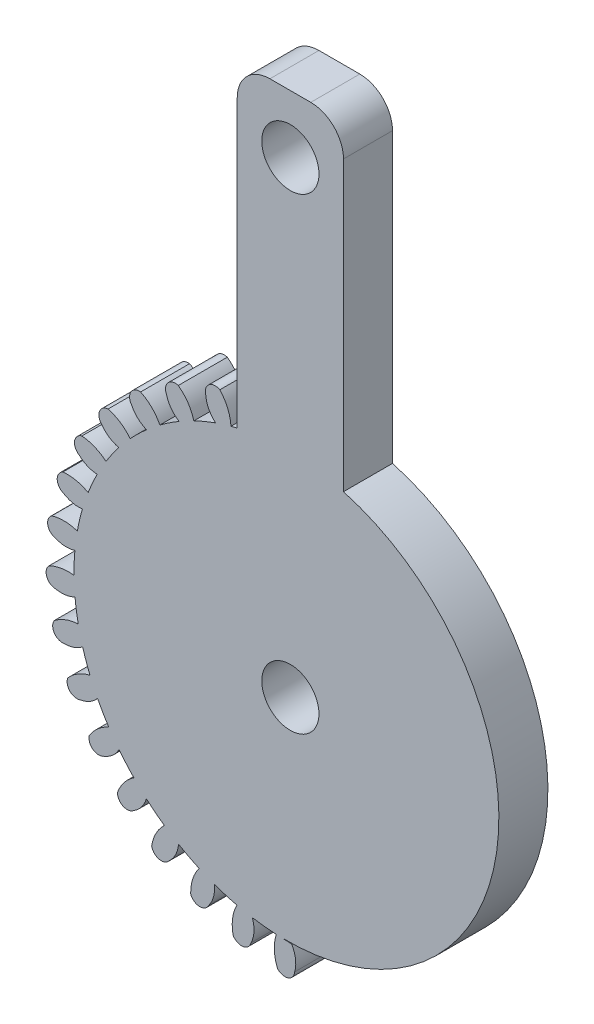
from build123d import *

# Parameters (mm, degrees)
SKETCH5_R           = 13
BOSS_EXTRUDE3_DEPTH = 3
SKETCH6_W           = 6.5
SKETCH6_H           = 20
BOSS_EXTRUDE4_DEPTH = 3
BOSS_EXTRUDE5_DEPTH = 3
SKETCH9_R           = 1.75
CUT_EXTRUDE1_DEPTH  = 3
FILLET1_R           = 2


with BuildPart() as part:
    # Sketch5 → Boss-Extrude3 (new body)
    with BuildSketch(Plane.XY.offset(3)):
        with Locations((0, 20.92523633)):
            Circle(SKETCH5_R)
    extrude(amount=BOSS_EXTRUDE3_DEPTH)

    # Sketch6 → Boss-Extrude4 (add)
    with BuildSketch(Plane.XY.offset(3)):
        with Locations((0.239986303, 43.081718219)):
            Rectangle(SKETCH6_W, SKETCH6_H)
    extrude(amount=BOSS_EXTRUDE4_DEPTH)

    # Sketch8 → Boss-Extrude5 (add)
    with BuildSketch(Plane.XY.offset(3)):
        with BuildLine():
            Line((-4.295994306, 33.146239501), (-3.38996239, 33.41049881))
            ThreePointArc((-3.38996239, 33.41049881), (-3.583611793, 34.300219718), (-4.075784869, 35.066293507))
            ThreePointArc((-4.075784869, 35.066293507), (-4.733344139, 35.009325085), (-4.939904397, 34.382457909))
            ThreePointArc((-4.939904397, 34.382457909), (-4.746199027, 33.697547192), (-4.295994306, 33.146239501))
        make_face()
        with BuildLine():
            Line((-6.479661136, 32.095481488), (-5.638197922, 32.522876474))
            ThreePointArc((-5.638197922, 32.522876474), (-5.993184011, 33.36138006), (-6.618649024, 34.023117852))
            ThreePointArc((-6.618649024, 34.023117852), (-7.254301529, 33.845422924), (-7.341262628, 33.191154353))
            ThreePointArc((-7.341262628, 33.191154353), (-7.024130865, 32.55393233), (-6.479661136, 32.095481488))
        make_face()
        with BuildLine():
            Line((-8.431105641, 30.65869425), (-7.68329101, 31.234454696))
            ThreePointArc((-7.68329101, 31.234454696), (-8.187345926, 31.992763359), (-8.924487613, 32.527296351))
            ThreePointArc((-8.924487613, 32.527296351), (-9.516266026, 32.235015826), (-9.480622702, 31.575956535))
            ThreePointArc((-9.480622702, 31.575956535), (-9.05102421, 31.008444775), (-8.431105641, 30.65869425))
        make_face()
        with BuildLine():
            Line((-10.082888425, 28.885531296), (-9.454565882, 29.589759666))
            ThreePointArc((-9.454565882, 29.589759666), (-10.090270139, 30.241667239), (-10.913613837, 30.630522663))
            ThreePointArc((-10.913613837, 30.630522663), (-11.44106706, 30.233757376), (-11.284051101, 29.592683602))
            ThreePointArc((-11.284051101, 29.592683602), (-10.756832248, 29.114494578), (-10.082888425, 28.885531296))
        make_face()
        with BuildLine():
            Line((-11.377926009, 26.837270843), (-10.89080957, 27.645629915))
            ThreePointArc((-10.89080957, 27.645629915), (-11.63619405, 28.168607317), (-12.517286067, 28.398346832))
            ThreePointArc((-12.517286067, 28.398346832), (-12.962185999, 27.910808479), (-12.689223673, 27.309874902))
            ThreePointArc((-12.689223673, 27.309874902), (-12.08260446, 26.937534209), (-11.377926009, 26.837270843))
        make_face()
        with BuildLine():
            Line((-12.271463571, 24.584698125), (-11.942387349, 25.469252055))
            ThreePointArc((-11.942387349, 25.469252055), (-12.77169253, 25.845225862), (-13.680083464, 25.907909968))
            ThreePointArc((-13.680083464, 25.907909968), (-14.027054939, 25.346447244), (-13.647579472, 24.806421351))
            ThreePointArc((-13.647579472, 24.806421351), (-12.982523874, 24.5527966), (-12.271463571, 24.584698125))
        make_face()
        with BuildLine():
            Line((-12.732621608, 22.20565914), (-12.572958051, 23.135838888))
            ThreePointArc((-12.572958051, 23.135838888), (-13.457524218, 23.351815933), (-14.361821254, 23.245278348))
            ThreePointArc((-14.361821254, 23.245278348), (-14.598873387, 22.629294678), (-14.125998959, 22.168839065))
            ThreePointArc((-14.125998959, 22.168839065), (-13.425490439, 22.042695201), (-12.732621608, 22.20565914))
        make_face()
        with BuildLine():
            Line((-12.745463094, 19.782370399), (-12.76072997, 20.726030156))
            ThreePointArc((-12.76072997, 20.726030156), (-13.669987659, 20.774546551), (-14.538939462, 20.502469076))
            ThreePointArc((-14.538939462, 20.502469076), (-14.657880036, 19.853252059), (-14.107948577, 19.488279478))
            ThreePointArc((-14.107948577, 19.488279478), (-13.396195802, 19.493975869), (-12.745463094, 19.782370399))
        make_face()
        with BuildLine():
            Line((-12.309544245, 17.398577627), (-12.499213949, 18.323105732))
            ThreePointArc((-12.499213949, 18.323105732), (-13.401740392, 18.202484813), (-14.20531711, 17.774270094))
            ThreePointArc((-14.20531711, 17.774270094), (-14.202035694, 17.114255831), (-13.594052123, 16.857379261))
            ThreePointArc((-13.594052123, 16.857379261), (-12.895652349, 16.994719047), (-12.309544245, 17.398577627))
        make_face()
        with BuildLine():
            Line((-11.439929852, 15.136661617), (-11.797447644, 16.010107576))
            ThreePointArc((-11.797447644, 16.010107576), (-12.662052694, 15.724517845), (-13.372483756, 15.154964429))
            ThreePointArc((-13.372483756, 15.154964429), (-13.247093752, 14.506962159), (-12.602069194, 14.367058922))
            ThreePointArc((-12.602069194, 14.367058922), (-11.941158214, 14.631295818), (-11.439929852, 15.136661617))
        make_face()
        with BuildLine():
            Line((-10.166672663, 13.074791263), (-10.679683192, 13.866969912))
            ThreePointArc((-10.679683192, 13.866969912), (-11.476487216, 13.426280982), (-12.069221043, 12.735071898))
            ThreePointArc((-12.069221043, 12.735071898), (-11.826055767, 12.121475741), (-11.166281438, 12.103380713))
            ThreePointArc((-11.166281438, 12.103380713), (-10.565699479, 12.485383033), (-10.166672663, 13.074791263))
        make_face()
        with BuildLine():
            Line((-8.533774801, 11.284222136), (-9.184549085, 11.967756807))
            ThreePointArc((-9.184549085, 11.967756807), (-9.886015568, 11.387198317), (-10.340568045, 10.598220857))
            ThreePointArc((-10.340568045, 10.598220857), (-9.988030974, 10.040235902), (-9.336307821, 10.144574423))
            ThreePointArc((-9.336307821, 10.144574423), (-8.816810221, 10.631140662), (-8.533774801, 11.284222136))
        make_face()
        with BuildLine():
            Line((-6.597667103, 9.826833991), (-7.363715226, 10.378102608))
            ThreePointArc((-7.363715226, 10.378102608), (-7.945602392, 9.677737908), (-8.246264774, 8.818258113))
            ThreePointArc((-8.246264774, 8.818258113), (-7.796539134, 8.3351676), (-7.175389866, 8.558333865))
            ThreePointArc((-7.175389866, 8.558333865), (-6.754929788, 9.132648922), (-6.597667103, 9.826833991))
        make_face()
        with BuildLine():
            Line((-4.425258947, 8.752992275), (-5.280107276, 9.152943708))
            ThreePointArc((-5.280107276, 9.152943708), (-5.722305859, 8.356976498), (-5.858687642, 7.456696877))
            ThreePointArc((-5.858687642, 7.456696877), (-5.327315369, 7.065195788), (-4.758206101, 7.399477461))
            ThreePointArc((-4.758206101, 7.399477461), (-4.451314103, 8.041693751), (-4.425258947, 8.752992275))
        make_face()
        with BuildLine():
            Line((-2.091625949, 8.09980757), (-3.005732032, 8.334620015))
            ThreePointArc((-3.005732032, 8.334620015), (-3.292960219, 7.470557891), (-3.260348227, 6.560590944))
            ThreePointArc((-3.260348227, 6.560590944), (-2.665692859, 6.274209051), (-2.168291272, 6.708053788))
            ThreePointArc((-2.168291272, 6.708053788), (-1.985573144, 7.395977147), (-2.091625949, 8.09980757))
        make_face()
        with BuildLine():
            Line((0.322584552, 7.889853094), (-0.61918896, 7.951411738))
            ThreePointArc((-0.61918896, 7.951411738), (-0.741520518, 7.049115568), (-0.541041777, 6.160908576))
            ThreePointArc((-0.541041777, 6.160908576), (0.096346165, 5.989542866), (0.504850516, 6.507957556))
            ThreePointArc((0.504850516, 6.507957556), (0.557080271, 7.217814242), (0.322584552, 7.889853094))
        make_face()
    extrude(amount=BOSS_EXTRUDE5_DEPTH)

    # Sketch9 → Cut-Extrude1 (cut)
    with BuildSketch(Plane(origin=(0, 0, 3), x_dir=(-1, 0, 0), z_dir=(0, 0, -1))):
        with Locations((-0.239986303, 49.531718219)):
            Circle(SKETCH9_R)
        with Locations((-0.239986303, 20.92523633)):
            Circle(SKETCH9_R)
    extrude(amount=-CUT_EXTRUDE1_DEPTH, mode=Mode.SUBTRACT)

    # Fillet1
    fillet1_edges = [part.edges().sort_by_distance(p)[0] for p in [
        (-3.010013697, 53.081718219, 4.5),
        (3.489986303, 53.081718219, 4.5),
    ]]
    fillet(fillet1_edges, radius=FILLET1_R)


solid = part.part
